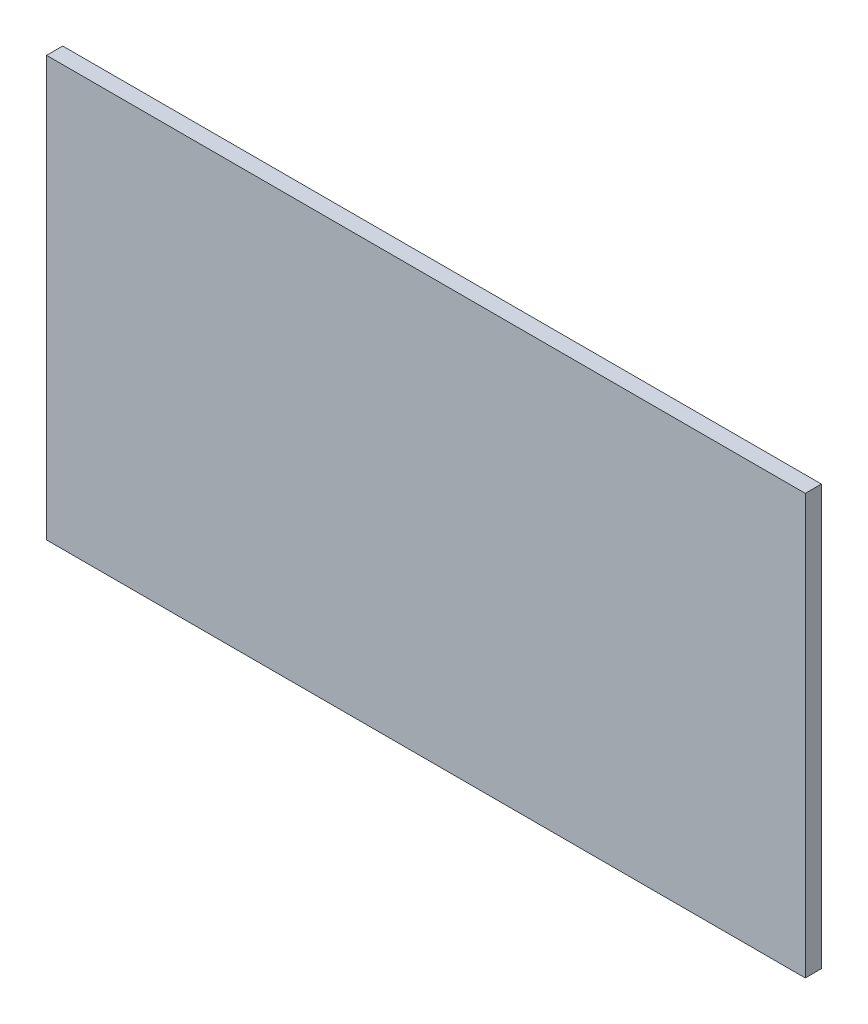
from build123d import *

# Parameters (mm, degrees)
SKETCH1_W           = 45
SKETCH1_H           = 24
BOSS_EXTRUDE1_DEPTH = 1
SKETCH2_W           = 47
SKETCH2_H           = 26
BOSS_EXTRUDE2_DEPTH = 1


with BuildPart() as part:
    # Sketch1 → Boss-Extrude1 (new body)
    with BuildSketch(Plane.XY.offset(40.959042005)):
        with Locations((18.613098235, 25.703029386)):
            Rectangle(SKETCH1_W, SKETCH1_H)
    extrude(amount=-BOSS_EXTRUDE1_DEPTH)

    # Sketch2 → Boss-Extrude2 (add)
    with BuildSketch(Plane.XY.offset(40.959042005)):
        with Locations((18.613098235, 25.703029386)):
            Rectangle(SKETCH2_W, SKETCH2_H)
    extrude(amount=BOSS_EXTRUDE2_DEPTH)


solid = part.part
